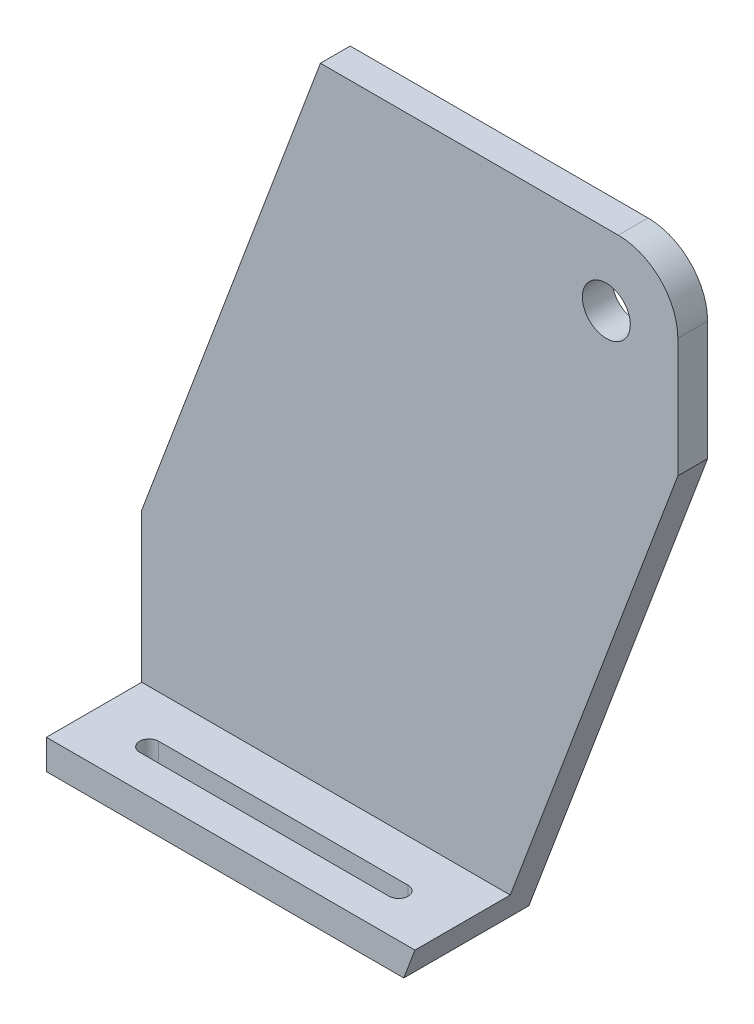
from build123d import *

# Parameters (mm, degrees)
SKETCH2_W           = 90
SKETCH2_H           = 5
BOSS_EXTRUDE1_DEPTH = 21
SKETCH3_W           = 90
SKETCH3_H           = 5
BOSS_EXTRUDE2_DEPTH = 105
FILLET1_R           = 10
SKETCH4_R           = 4.025
CUT_EXTRUDE1_DEPTH  = 118.631840928
CUT_EXTRUDE2_DEPTH  = 119.415581745
CUT_EXTRUDE3_DEPTH  = 10


with BuildPart() as part:
    # Sketch2 → Boss-Extrude1 (new body)
    with BuildSketch(Plane.XY):
        Rectangle(SKETCH2_W, SKETCH2_H)
    extrude(amount=BOSS_EXTRUDE1_DEPTH)

    # Sketch3 → Boss-Extrude2 (add)
    with BuildSketch(Plane(origin=(0, 2.5, 0), x_dir=(1, 0, 0), z_dir=(0, 1, 0))):
        with Locations((0, -2.5)):
            Rectangle(SKETCH3_W, SKETCH3_H)
    extrude(amount=BOSS_EXTRUDE2_DEPTH)

    # Fillet1
    fillet1_edges = [part.edges().sort_by_distance(p)[0] for p in [
        (45, 107.5, 2.5),
    ]]
    fillet(fillet1_edges, radius=FILLET1_R)

    # Sketch4 → Cut-Extrude1 (cut, through all)
    with BuildSketch(Plane.XY.offset(5)):
        with Locations((33, 95.5)):
            Circle(SKETCH4_R)
    extrude(amount=-CUT_EXTRUDE1_DEPTH, mode=Mode.SUBTRACT)

    # Sketch6 → Cut-Extrude2 (cut, through all)
    with BuildSketch(Plane.XY.offset(21)):
        Polygon((45, 77.5), (15, -2.5), (45, -2.5), align=None)
        Polygon((-45, 27.5), (-15, 107.5), (-45, 107.5), align=None)
    extrude(amount=-CUT_EXTRUDE2_DEPTH, mode=Mode.SUBTRACT)

    # Sketch7 → Cut-Extrude3 (cut)
    with BuildSketch(Plane(origin=(0, 2.5, 0), x_dir=(1, 0, 0), z_dir=(0, 1, 0))):
        with BuildLine():
            Line((6.875, -15.35), (-35, -15.35))
            ThreePointArc((-35, -15.35), (-36.6, -13.75), (-35, -12.15))
            Line((-35, -12.15), (6.875, -12.15))
            ThreePointArc((6.875, -12.15), (8.475, -13.75), (6.875, -15.35))
        make_face()
    extrude(amount=-CUT_EXTRUDE3_DEPTH, mode=Mode.SUBTRACT)


solid = part.part
